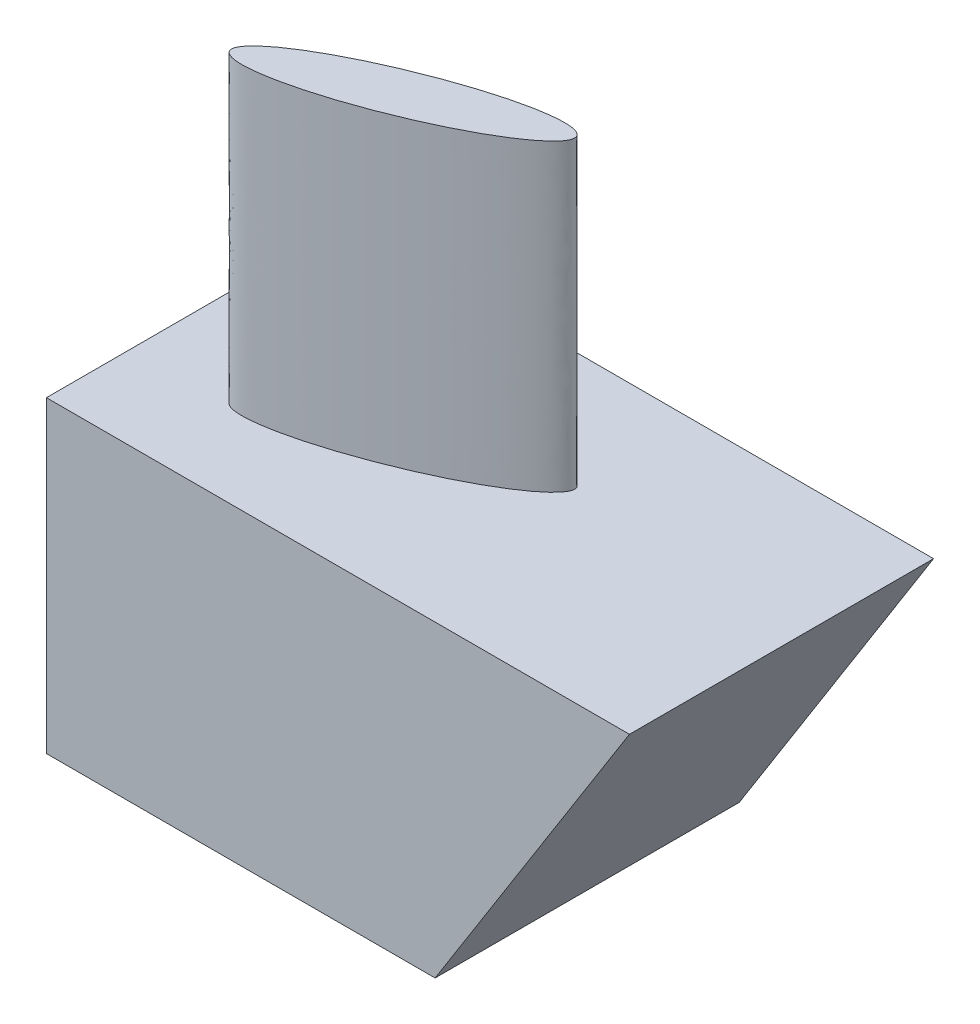
from build123d import *

# Parameters (mm, degrees)
BOSS_EXTRUDE1_DEPTH = 79.502
SKETCH2_RX          = 34.87252212
SKETCH2_RY          = 7.136819482
BOSS_EXTRUDE2_DEPTH = 79.502


with BuildPart() as part:
    # Sketch1 → Boss-Extrude1 (new body)
    with BuildSketch(Plane.XY):
        Polygon((0, 0), (101.6, 0), (152.4, 80.572467382), (0, 80.572467382), align=None)
    extrude(amount=BOSS_EXTRUDE1_DEPTH)

    # Sketch2 → Boss-Extrude2 (add)
    with BuildSketch(Plane(origin=(0, 80.572467382, 0), x_dir=(1, 0, 0), z_dir=(0, 1, 0))):
        with Locations(Location((57.268893284, -43.52674359), (0, 0, 21.757695584))):
            Ellipse(SKETCH2_RX, SKETCH2_RY)
    extrude(amount=BOSS_EXTRUDE2_DEPTH)


solid = part.part
